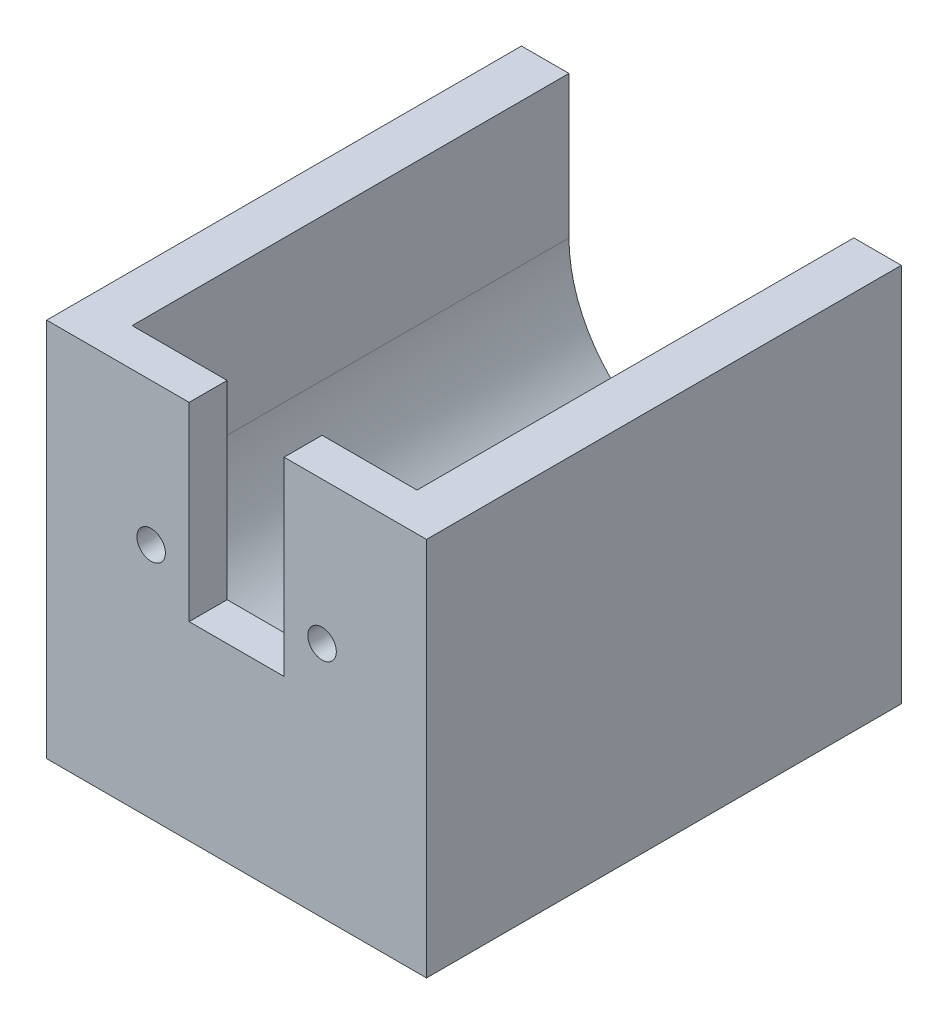
from build123d import *

# Parameters (mm, degrees)
IZIM1_W                     = 20
IZIM1_H                     = 25
Y_KSEKLIK_EKSTR_ZYON1_DEPTH = 20
KES_EKSTR_ZYON3_DEPTH       = 32
IZIM3_R                     = 3
KES_EKSTR_ZYON4_DEPTH       = 17
Y_KSEKLIK_EKSTR_ZYON2_DEPTH = 2
IZIM5_R                     = 0.75
KES_EKSTR_ZYON5_DEPTH       = 32


with BuildPart() as part:
    # Çizim1 → Yükseklik-Ekstrüzyon1 (new body)
    with BuildSketch(Plane(origin=(0, 0, 0), x_dir=(1, 0, 0), z_dir=(0, 1, 0))):
        with Locations((10, 12.5)):
            Rectangle(IZIM1_W, IZIM1_H)
    extrude(amount=Y_KSEKLIK_EKSTR_ZYON1_DEPTH)

    # Çizim2 → Kes-Ekstrüzyon3 (cut)
    with BuildSketch(Plane.XY):
        with BuildLine():
            Line((2.5, 12.5), (2.5, 20))
            Line((2.5, 20), (17.5, 20))
            Line((17.5, 20), (17.5, 12.5))
            ThreePointArc((17.5, 12.5), (10, 5), (2.5, 12.5))
        make_face()
    extrude(amount=-KES_EKSTR_ZYON3_DEPTH, mode=Mode.SUBTRACT)

    # Çizim3 → Kes-Ekstrüzyon4 (cut)
    with BuildSketch(Plane(origin=(0, 20, 0), x_dir=(1, 0, 0), z_dir=(0, 1, 0))):
        with Locations(Location((10, 10, 0), (0, 0, 270))):
            Circle(IZIM3_R)
        with Locations(Location((10, 19, 0), (0, 0, 270))):
            Circle(IZIM3_R)
    extrude(amount=-KES_EKSTR_ZYON4_DEPTH, mode=Mode.SUBTRACT)

    # Çizim4 → Yükseklik-Ekstrüzyon2 (add)
    with BuildSketch(Plane.XY):
        Polygon((12.5, 20), (20, 20), (20, 0), (0, 0), (0, 20), (7.5, 20), (7.5, 10), (12.5, 10), align=None)
    extrude(amount=-Y_KSEKLIK_EKSTR_ZYON2_DEPTH)

    # Çizim5 → Kes-Ekstrüzyon5 (cut)
    with BuildSketch(Plane(origin=(0, 0, -25), x_dir=(-1, 0, 0), z_dir=(0, 0, -1))):
        with Locations((-14.5, 12.5)):
            Circle(IZIM5_R)
        with Locations((-5.5, 12.5)):
            Circle(IZIM5_R)
    extrude(amount=-KES_EKSTR_ZYON5_DEPTH, mode=Mode.SUBTRACT)


solid = part.part
